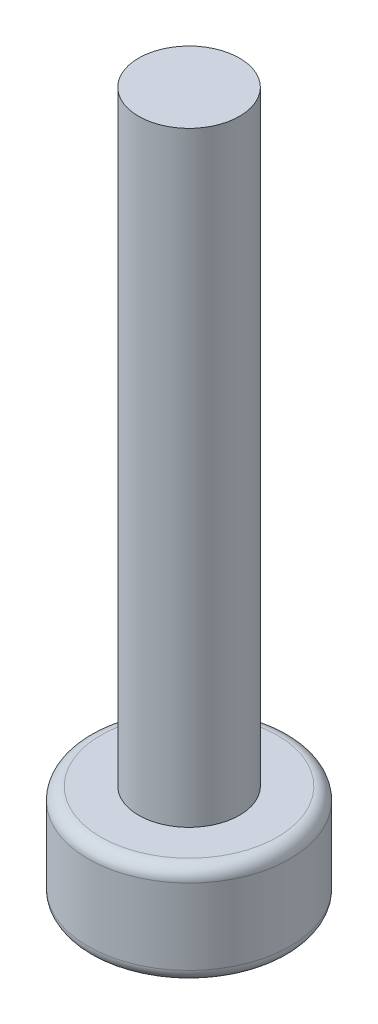
from build123d import *

# Parameters (mm, degrees)
SKETCH1_R           = 1
BOSS_EXTRUDE1_DEPTH = 12
SKETCH1_3_R         = 2
BOSS_EXTRUDE2_DEPTH = 2
CUT_EXTRUDE1_DEPTH  = 2
FILLET1_R           = 0.25


with BuildPart() as part:
    # Sketch1 → Boss-Extrude1 (new body)
    with BuildSketch(Plane(origin=(0, 0, 0), x_dir=(1, 0, 0), z_dir=(0, 1, 0))):
        Circle(SKETCH1_R)
    extrude(amount=BOSS_EXTRUDE1_DEPTH)

    # Sketch1<3> → Boss-Extrude2 (add)
    with BuildSketch(Plane(origin=(0, 0, 0), x_dir=(1, 0, 0), z_dir=(0, 1, 0))):
        Circle(SKETCH1_3_R)
    extrude(amount=-BOSS_EXTRUDE2_DEPTH)

    # Sketch2 → Cut-Extrude1 (cut)
    with BuildSketch(Plane.XZ.offset(2)):
        Polygon((0, 0.866025404), (-0.75, 0.433012702), (-0.75, -0.433012702), (0, -0.866025404), (0.75, -0.433012702), (0.75, 0.433012702), align=None)
    extrude(amount=-CUT_EXTRUDE1_DEPTH, mode=Mode.SUBTRACT)

    # Fillet1
    fillet1_edges = [part.edges().sort_by_distance(p)[0] for p in [
        (-2, 0, 0),
        (-2, -2, 0),
    ]]
    fillet(fillet1_edges, radius=FILLET1_R)


solid = part.part
